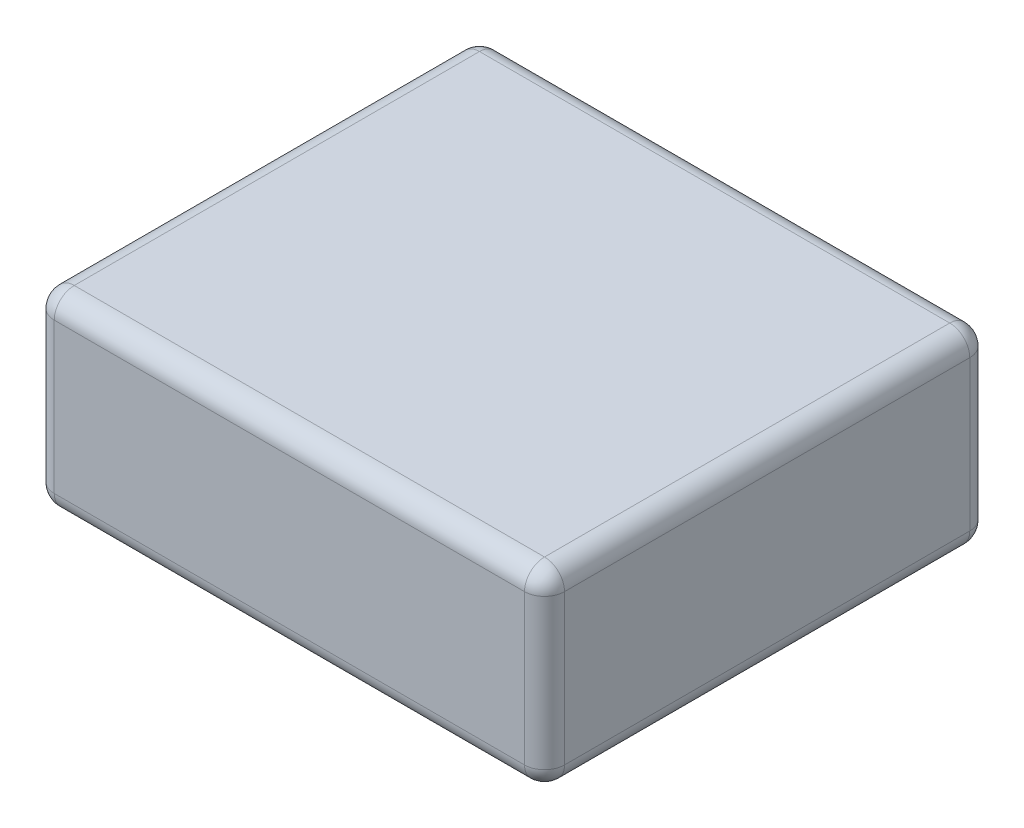
from build123d import *

# Parameters (mm, degrees)
SKETCH2_W           = 102
SKETCH2_H           = 89
BOSS_EXTRUDE1_DEPTH = 38
FILLET1_R           = 4


with BuildPart() as part:
    # Sketch2 → Boss-Extrude1 (new body)
    with BuildSketch(Plane(origin=(0, 0, 0), x_dir=(1, 0, 0), z_dir=(0, 1, 0))):
        with Locations((6.5, 0)):
            Rectangle(SKETCH2_W, SKETCH2_H)
    extrude(amount=BOSS_EXTRUDE1_DEPTH)

    # Fillet1
    fillet1_edges = [part.edges().sort_by_distance(p)[0] for p in [
        (57.5, 38, 0),
        (6.5, 38, -44.5),
        (-44.5, 38, 0),
        (6.5, 0, -44.5),
        (57.5, 0, 0),
        (6.5, 0, 44.5),
        (-44.5, 0, 0),
        (-44.5, 19, -44.5),
        (57.5, 19, -44.5),
        (57.5, 19, 44.5),
        (-44.5, 19, 44.5),
        (6.5, 38, 44.5),
    ]]
    fillet(fillet1_edges, radius=FILLET1_R)


solid = part.part
